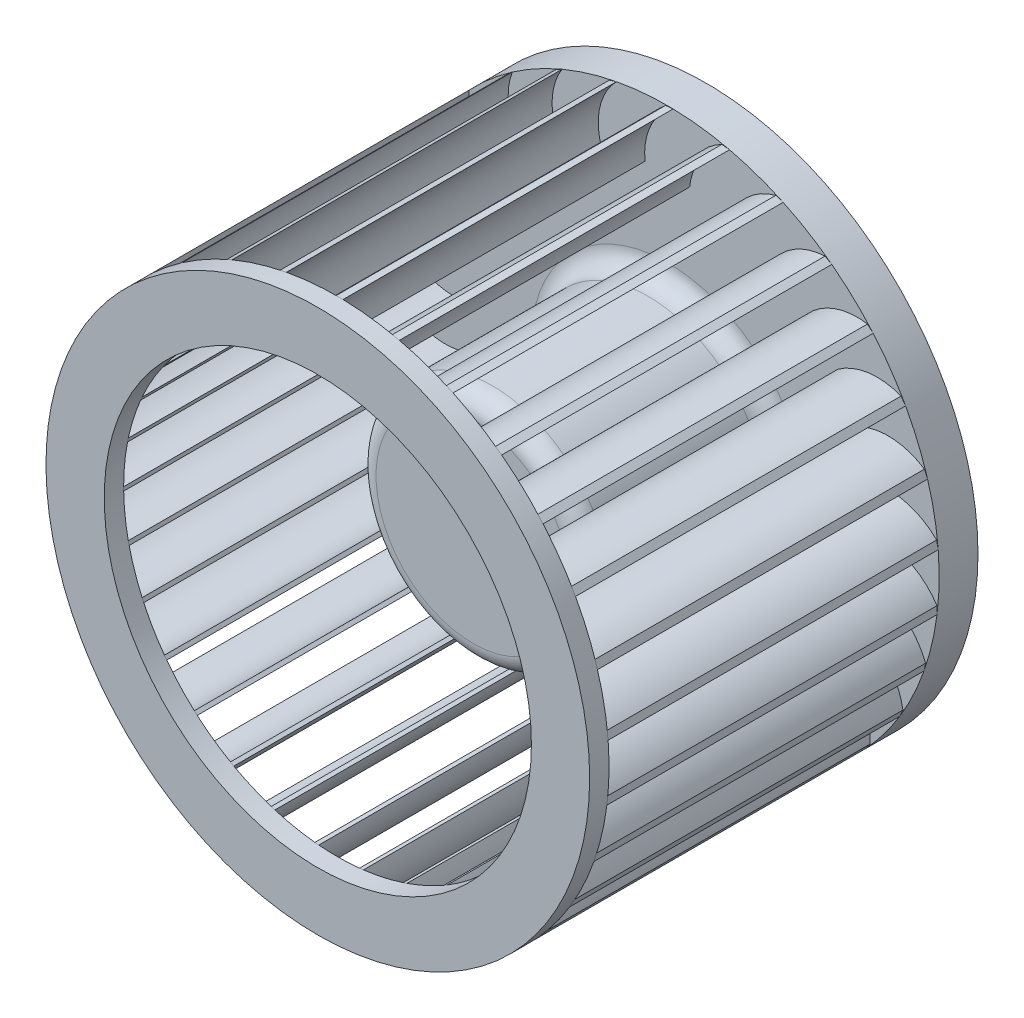
from build123d import *

# Parameters (mm, degrees)
SKETCH2_R           = 14
BOSS_EXTRUDE1_DEPTH = 2
SKETCH7_R           = 6
BOSS_EXTRUDE2_DEPTH = 10
BOSS_EXTRUDE3_DEPTH = 17
CIRPATTERN1_COUNT   = 30
SKETCH9_R           = 14
SKETCH9_R_2         = 11
BOSS_EXTRUDE4_DEPTH = 1
FILLET1_R           = 1


with BuildPart() as part:
    # Sketch2 → Boss-Extrude1 (new body)
    with BuildSketch(Plane.XY):
        Circle(SKETCH2_R)
    extrude(amount=BOSS_EXTRUDE1_DEPTH)

    # Sketch7 → Boss-Extrude2 (add)
    with BuildSketch(Plane.XY.offset(2)):
        Circle(SKETCH7_R)
    extrude(amount=BOSS_EXTRUDE2_DEPTH)

    # Sketch8 → Boss-Extrude3 (add)
    with BuildSketch(Plane.XY.offset(2)):
        with BuildLine():
            Line((13.888810578, -1.760948811), (13.888810578, -1.363926448))
            ThreePointArc((13.888810578, -1.363926448), (12.642489916, -0.21607072), (11, 0.2))
            Line((11, 0.2), (11, 0))
            ThreePointArc((11, 0), (12.691609239, -0.474939968), (13.888810578, -1.760948811))
        make_face()
    boss_extrude3 = extrude(amount=BOSS_EXTRUDE3_DEPTH)

    # CirPattern1: Boss-Extrude3 ×30 about axis
    cirpattern1_axis = Axis((0, 0, 0), (0, 0, 1))
    for i in range(1, CIRPATTERN1_COUNT):
        add(boss_extrude3.rotate(cirpattern1_axis, i * 360 / CIRPATTERN1_COUNT))

    # Sketch9 → Boss-Extrude4 (add)
    with BuildSketch(Plane.XY.offset(19)):
        with Locations(Location((0, 0, 0), (0, 0, 184.774079127))):
            Circle(SKETCH9_R)
        Circle(SKETCH9_R_2, mode=Mode.SUBTRACT)
    extrude(amount=BOSS_EXTRUDE4_DEPTH)

    # Fillet1
    fillet1_edges = [part.edges().sort_by_distance(p)[0] for p in [
        (-6, 0, 2),
        (-6, 0, 12),
    ]]
    fillet(fillet1_edges, radius=FILLET1_R)


solid = part.part
